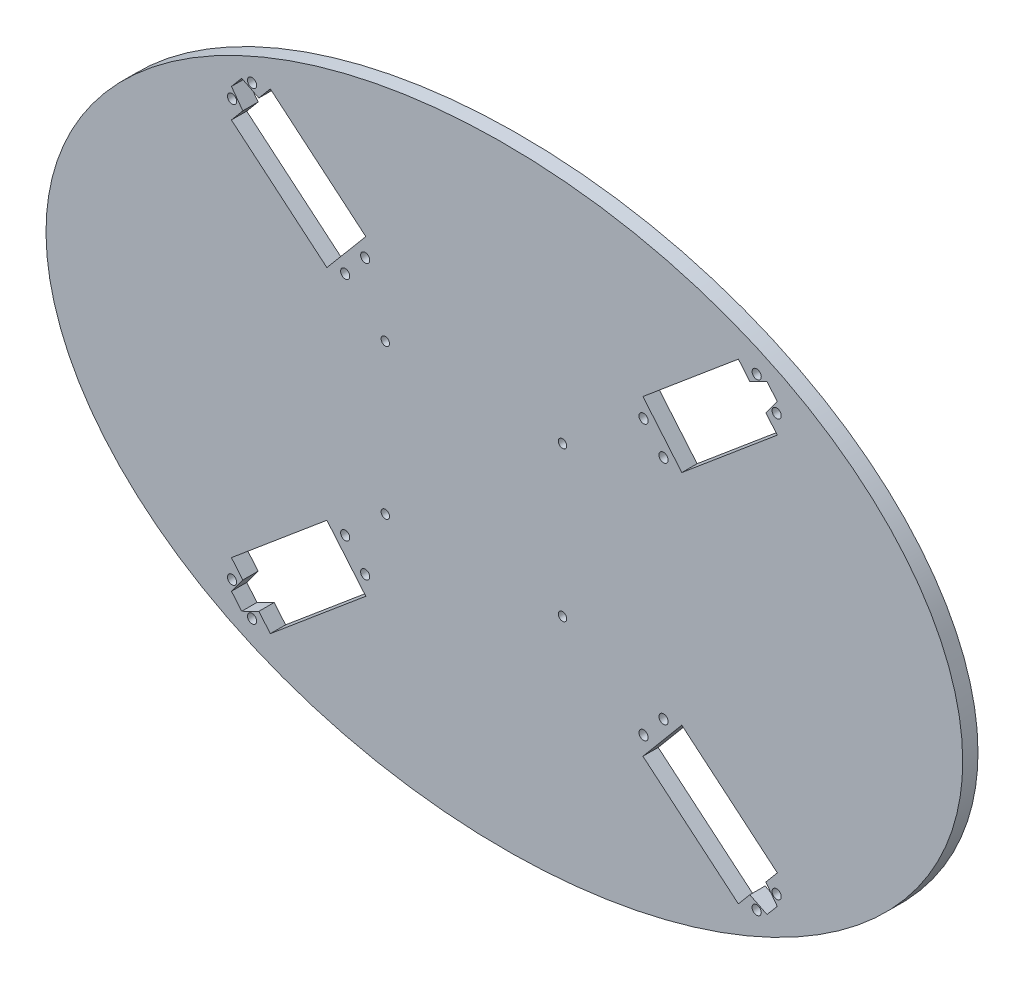
from build123d import *

# Parameters (mm, degrees)
SKETCH1_RX           = 150
SKETCH1_RY           = 100
BOSS_EXTRUDE1_DEPTH  = 5
CUT_EXTRUDE2_DEPTH   = 181.346887969
SKETCH19_R           = 1.5
CUT_EXTRUDE3_DEPTH   = 181.346887969
CUT_EXTRUDE4_DEPTH   = 181.346887969
MIRROR2_COPY_1_DEPTH = 181.346887969
SKETCH22_R           = 1.375
CUT_EXTRUDE5_DEPTH   = 181.346887969


with BuildPart() as part:
    # Sketch1 → Boss-Extrude1 (new body)
    with BuildSketch(Plane.XY.offset(5)):
        with Locations(Location((0, 0), (0, 0, 0))):
            Ellipse(SKETCH1_RX, SKETCH1_RY)
    extrude(amount=-BOSS_EXTRUDE1_DEPTH)

    # Sketch18 → Cut-Extrude2 (cut, through all)
    with BuildSketch(Plane.XY.offset(5)):
        Polygon((-89.323679082, -62.022736108), (-58.07385358, -35.801019055), (-51.707696778, -43.387909295), (-45.341539976, -50.974799535), (-76.591365477, -77.196516588), align=None)
        Polygon((-89.323679082, 62.022736108), (-76.591365477, 77.196516588), (-45.341539976, 50.974799535), (-51.707696778, 43.387909295), (-58.07385358, 35.801019055), align=None)
        Polygon((51.707696778, -43.387909295), (45.341539976, -50.974799535), (76.591365477, -77.196516588), (89.323679082, -62.022736108), (58.07385358, -35.801019055), align=None)
        Polygon((58.07385358, 35.801019055), (51.707696778, 43.387909295), (45.341539976, 50.974799535), (76.591365477, 77.196516588), (89.323679082, 62.022736108), align=None)
    extrude(amount=-CUT_EXTRUDE2_DEPTH, mode=Mode.SUBTRACT)

    # Sketch19 → Cut-Extrude3 (cut, through all)
    with BuildSketch(Plane.XY.offset(5)):
        with Locations((-52.093329986, -37.069886693)):
            Circle(SKETCH19_R)
        with Locations(Location((-45.552623639, -44.86479698, 0), (0, 0, 180))):
            Circle(SKETCH19_R)
        with Locations((-82.571889071, -75.927648951)):
            Circle(SKETCH19_R)
        with Locations(Location((-89.112595418, -68.132738663, 0), (0, 0, 180))):
            Circle(SKETCH19_R)
        with Locations((-89.112595418, 68.132738663)):
            Circle(SKETCH19_R)
        with Locations(Location((-82.571889071, 75.927648951, 0), (0, 0, 180))):
            Circle(SKETCH19_R)
        with Locations((-45.552623639, 44.86479698)):
            Circle(SKETCH19_R)
        with Locations(Location((-52.093329986, 37.069886693, 0), (0, 0, 180))):
            Circle(SKETCH19_R)
        with Locations((52.093329986, 37.069886693)):
            Circle(SKETCH19_R)
        with Locations(Location((45.552623639, 44.86479698, 0), (0, 0, 180))):
            Circle(SKETCH19_R)
        with Locations((82.571889071, 75.927648951)):
            Circle(SKETCH19_R)
        with Locations(Location((89.112595418, 68.132738663, 0), (0, 0, 180))):
            Circle(SKETCH19_R)
        with Locations((89.112595418, -68.132738663)):
            Circle(SKETCH19_R)
        with Locations(Location((82.571889071, -75.927648951, 0), (0, 0, 180))):
            Circle(SKETCH19_R)
        with Locations((45.552623639, -44.86479698)):
            Circle(SKETCH19_R)
        with Locations(Location((52.093329986, -37.069886693, 0), (0, 0, 180))):
            Circle(SKETCH19_R)
    extrude(amount=-CUT_EXTRUDE3_DEPTH, mode=Mode.SUBTRACT)

    # Sketch21 → Cut-Extrude4 (cut, through all)
    with BuildSketch(Plane(origin=(0, 0, 0), x_dir=(-1, 0, 0), z_dir=(0, 0, -1))):
        Polygon((85.580702241, -66.483442205), (89.307086593, -71.533729271), (85.954984028, -75.528609546), (80.334342318, -72.735810491), align=None)
    cut_extrude4 = extrude(amount=-CUT_EXTRUDE4_DEPTH, mode=Mode.SUBTRACT)

    # Mirror1: Cut-Extrude4 across plane
    add(cut_extrude4.mirror(Plane.ZX), mode=Mode.SUBTRACT)

    # Mirror2: Cut-Extrude4 across plane
    add(cut_extrude4.mirror(Plane(origin=(0, 0, 0), x_dir=(0, 0, 1), z_dir=(1, 0, 0))), mode=Mode.SUBTRACT)

    # Mirror2 copy 1 sketch → Mirror2 copy 1 (cut, through all)
    with BuildSketch(Plane(origin=(0, 0, 0), x_dir=(1, 0, 0), z_dir=(0, 0, -1))):
        Polygon((85.580702241, -66.483442205), (89.307086593, -71.533729271), (85.954984028, -75.528609546), (80.334342318, -72.735810491), align=None)
    extrude(amount=-MIRROR2_COPY_1_DEPTH, mode=Mode.SUBTRACT)

    # Sketch22 → Cut-Extrude5 (cut, through all)
    with BuildSketch(Plane.XY.offset(5)):
        with Locations((-38.962083673, -24.5)):
            Circle(SKETCH22_R)
        with Locations((19.037916327, -24.5)):
            Circle(SKETCH22_R)
        with Locations((19.037916327, 24.5)):
            Circle(SKETCH22_R)
        with Locations((-38.962083673, 24.5)):
            Circle(SKETCH22_R)
    extrude(amount=-CUT_EXTRUDE5_DEPTH, mode=Mode.SUBTRACT)


solid = part.part
